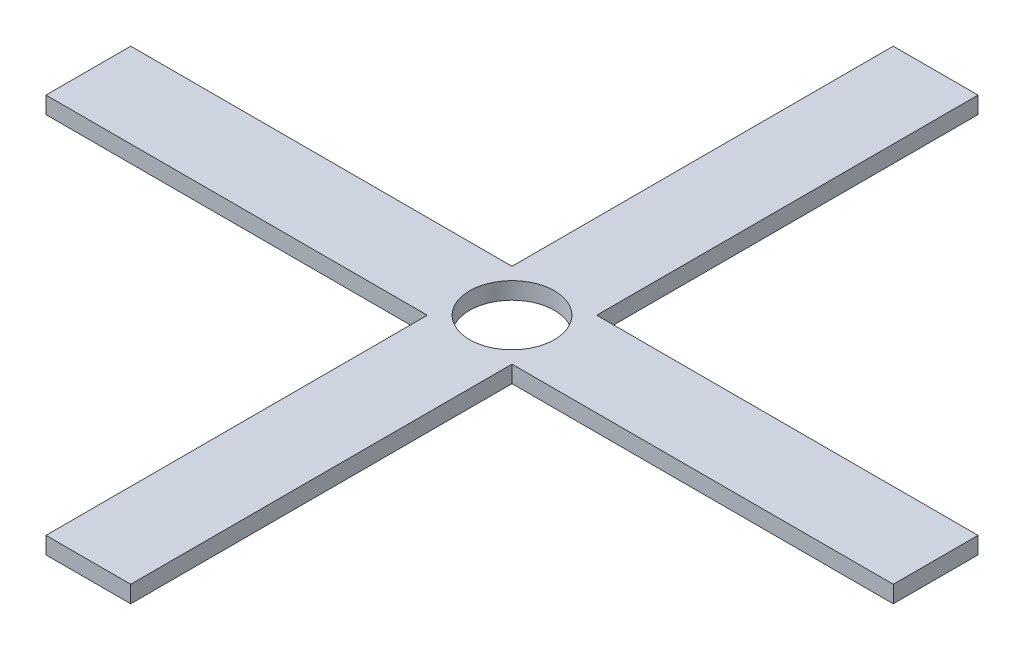
from build123d import *

# Parameters (mm, degrees)
SKETCH1_W               = 5
SKETCH1_H               = 0.5
BOSS_EXTRUDE1_DEPTH     = 0.1
SKETCH2_W               = 0.5
SKETCH2_H               = 5
BOSS_EXTRUDE2_DEPTH     = 0.1
CUT_EXTRUDE1_DEPTH      = 4.536947837
CUT_EXTRUDE1_DEPTH_BACK = 4.536947837
SKETCH3_R               = 0.25


with BuildPart() as part:
    # Sketch1 → Boss-Extrude1 (new body)
    with BuildSketch(Plane(origin=(0, 0, 0), x_dir=(1, 0, 0), z_dir=(0, 1, 0))):
        Rectangle(SKETCH1_W, SKETCH1_H)
    extrude(amount=BOSS_EXTRUDE1_DEPTH)

    # Sketch2 → Boss-Extrude2 (add)
    with BuildSketch(Plane(origin=(0, 0, 0), x_dir=(1, 0, 0), z_dir=(0, 1, 0))):
        Rectangle(SKETCH2_W, SKETCH2_H)
    extrude(amount=BOSS_EXTRUDE2_DEPTH)

    # Sketch3 → Cut-Extrude1 (cut, two sides: drawn at the far end of the back side and taken through both)
    with BuildSketch(Plane(origin=(0, 0.1, 0), x_dir=(1, 0, 0), z_dir=(0, 1, 0)).offset(-CUT_EXTRUDE1_DEPTH_BACK)):
        with Locations(Location((0, 0, 0), (0, 0, 270))):
            Circle(SKETCH3_R)
    extrude(amount=CUT_EXTRUDE1_DEPTH + CUT_EXTRUDE1_DEPTH_BACK, mode=Mode.SUBTRACT)


solid = part.part
